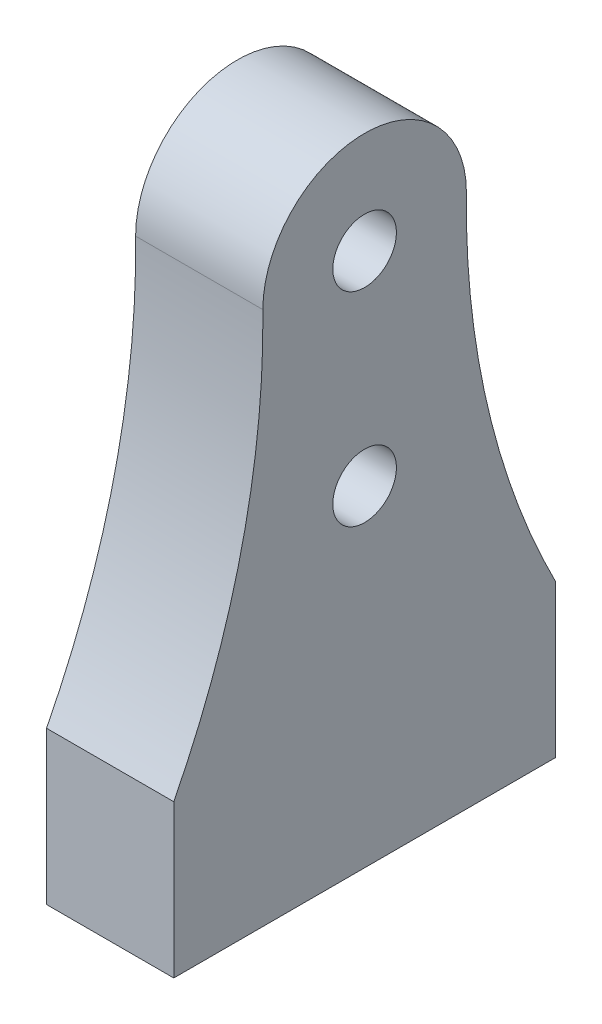
from build123d import *

# Parameters (mm, degrees)
BOSS_EXTRUDE1_DEPTH         = 2.5
TAP_DRILL_FOR_M3_TAP1_D     = 2.5
TAP_DRILL_FOR_M3_TAP2_D     = 2.5
TAP_DRILL_FOR_M3_TAP2_DEPTH = 5
TAP_DRILL_FOR_M3_TAP2_TIP   = 0.751075774


with BuildPart() as part:
    # Sketch1 → Boss-Extrude1 (new, symmetric)
    with BuildSketch(Plane(origin=(0, 0, 0), x_dir=(0, 0, -1), z_dir=(1, 0, 0))):
        with BuildLine():
            Line((-7.5, -12.5), (7.5, -12.5))
            Line((7.5, -12.5), (7.5, -6.5))
            ThreePointArc((7.5, -6.5), (4.834023326, 0.786272109), (4, 8.5))
            ThreePointArc((4, 8.5), (0, 12.5), (-4, 8.5))
            ThreePointArc((-4, 8.5), (-4.834023326, 0.786272109), (-7.5, -6.5))
            Line((-7.5, -6.5), (-7.5, -12.5))
        make_face()
    extrude(amount=BOSS_EXTRUDE1_DEPTH, both=True)

    # Tap Drill for M3 Tap1 (through all)
    with Locations(Plane(origin=(2.5, 0, 0), x_dir=(0, 0, -1), z_dir=(1, 0, 0))):
        with Locations((0, 8.5), (0, 0.5)):
            Hole(TAP_DRILL_FOR_M3_TAP1_D / 2)

    # Tap Drill for M3 Tap2
    with Locations(Plane(origin=(0, -12.5, 0), x_dir=(-1, 0, 0), z_dir=(0, -1, 0))):
        with Locations((0, -3.25), (0, 3.25)):
            Hole(TAP_DRILL_FOR_M3_TAP2_D / 2, depth=TAP_DRILL_FOR_M3_TAP2_DEPTH)
            with Locations((0, 0, -(TAP_DRILL_FOR_M3_TAP2_DEPTH + TAP_DRILL_FOR_M3_TAP2_TIP / 2))):  # 118° drill point
                Cone(0, TAP_DRILL_FOR_M3_TAP2_D / 2, TAP_DRILL_FOR_M3_TAP2_TIP, mode=Mode.SUBTRACT)


solid = part.part
